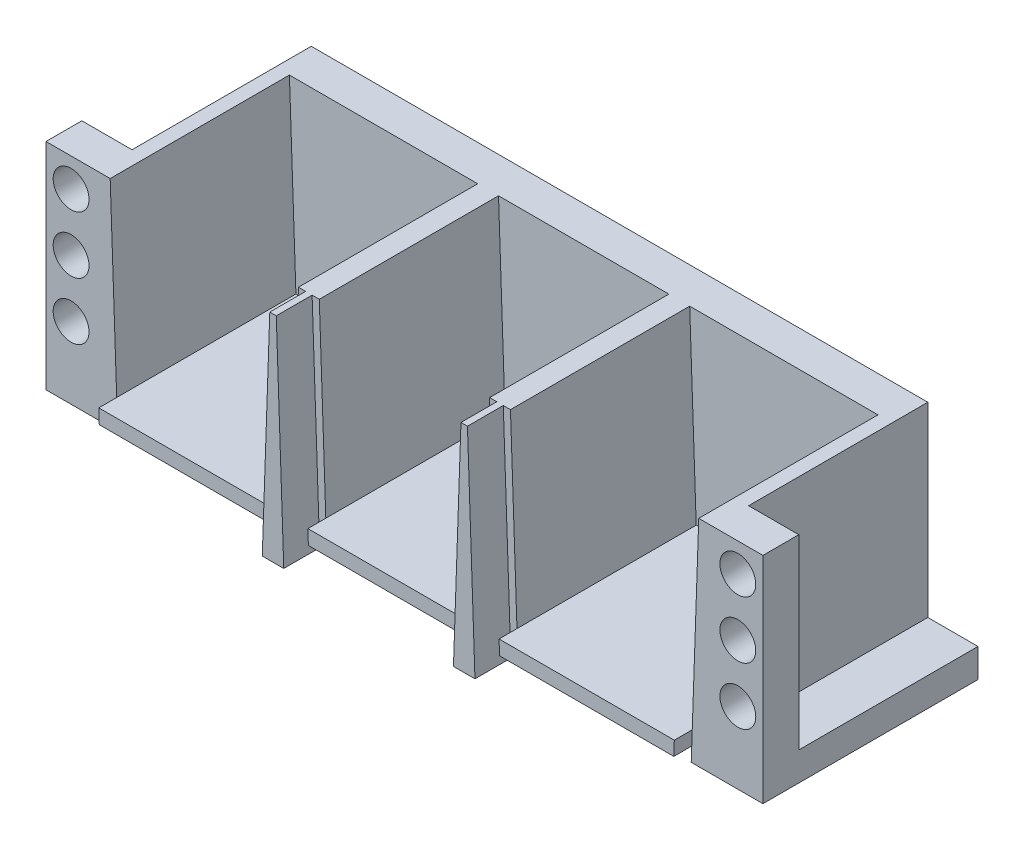
from build123d import *

# Parameters (mm, degrees)
SKETCH3_W           = 100
SKETCH3_H           = 30
BOSS_EXTRUDE1_DEPTH = 30
SKETCH3_6_R         = 2.5
CUT_EXTRUDE1_DEPTH  = 25
CUT_EXTRUDE3_START  = -5
SKETCH3_9_W         = 7
SKETCH3_9_H         = 26
CUT_EXTRUDE3_DEPTH  = 104.627804912
CUT_EXTRUDE4_DEPTH  = 2.5
BOSS_EXTRUDE2_DEPTH = 2.5
BOSS_EXTRUDE3_DEPTH = 5


with BuildPart() as part:
    # Sketch3 → Boss-Extrude1 (new body)
    with BuildSketch(Plane.XY):
        with Locations((50, -15)):
            Rectangle(SKETCH3_W, SKETCH3_H)
    extrude(amount=-BOSS_EXTRUDE1_DEPTH)

    # Sketch3<6> → Cut-Extrude1 (cut)
    with BuildSketch(Plane.XY):
        Polygon((35.214289751, 0), (8.952376915, 0), (9.860316922, -26), (34.306349745, -26), align=None)
        Polygon((61.880956418, 0), (38.119043582, 0), (39.026983589, -26), (60.973016411, -26), align=None)
        Polygon((91.047623085, 0), (64.785710249, 0), (65.693650255, -26), (90.139683078, -26), align=None)
        with Locations((3.5, -4)):
            Circle(SKETCH3_6_R)
        with Locations((3.5, -12)):
            Circle(SKETCH3_6_R)
        with Locations((3.5, -20)):
            Circle(SKETCH3_6_R)
        with Locations((96.5, -4)):
            Circle(SKETCH3_6_R)
        with Locations((96.5, -12)):
            Circle(SKETCH3_6_R)
        with Locations((96.5, -20)):
            Circle(SKETCH3_6_R)
    extrude(amount=-CUT_EXTRUDE1_DEPTH, mode=Mode.SUBTRACT)

    # Sketch3<9> → Cut-Extrude3 (cut, through all)
    with BuildSketch(Plane.XY.offset(CUT_EXTRUDE3_START)):
        with Locations((3.5, -13)):
            Rectangle(SKETCH3_9_W, SKETCH3_9_H)
        with Locations((96.5, -13)):
            Rectangle(SKETCH3_9_W, SKETCH3_9_H)
    extrude(amount=-CUT_EXTRUDE3_DEPTH, mode=Mode.SUBTRACT)

    # Sketch3<10> → Cut-Extrude4 (cut)
    with BuildSketch(Plane.XY):
        Polygon((34.236508206, -28), (9.930158461, -28), (10, -30), (34.166666667, -30), align=None)
        Polygon((60.903174872, -28), (39.096825128, -28), (39.166666667, -30), (60.833333333, -30), align=None)
        Polygon((90.069841539, -28), (65.763491794, -28), (65.833333333, -30), (90, -30), align=None)
    extrude(amount=-CUT_EXTRUDE4_DEPTH, mode=Mode.SUBTRACT)

    # Sketch3<11> → Boss-Extrude2 (add)
    with BuildSketch(Plane.XY):
        Polygon((34.306349745, -26), (9.860316922, -26), (9.930158461, -28), (34.236508206, -28), align=None)
        Polygon((60.973016411, -26), (39.026983589, -26), (39.096825128, -28), (60.903174872, -28), align=None)
        Polygon((90.139683078, -26), (65.693650255, -26), (65.763491794, -28), (90.069841539, -28), align=None)
    extrude(amount=BOSS_EXTRUDE2_DEPTH)

    # Sketch3<12> → Boss-Extrude3 (add)
    with BuildSketch(Plane.XY):
        Polygon((37.118434038, 0), (36.214899296, 0), (35.167276211, -30), (38.166057122, -30), align=None)
        Polygon((63.785100704, 0), (62.881565962, 0), (61.833942878, -30), (64.832723789, -30), align=None)
    extrude(amount=BOSS_EXTRUDE3_DEPTH)


solid = part.part
